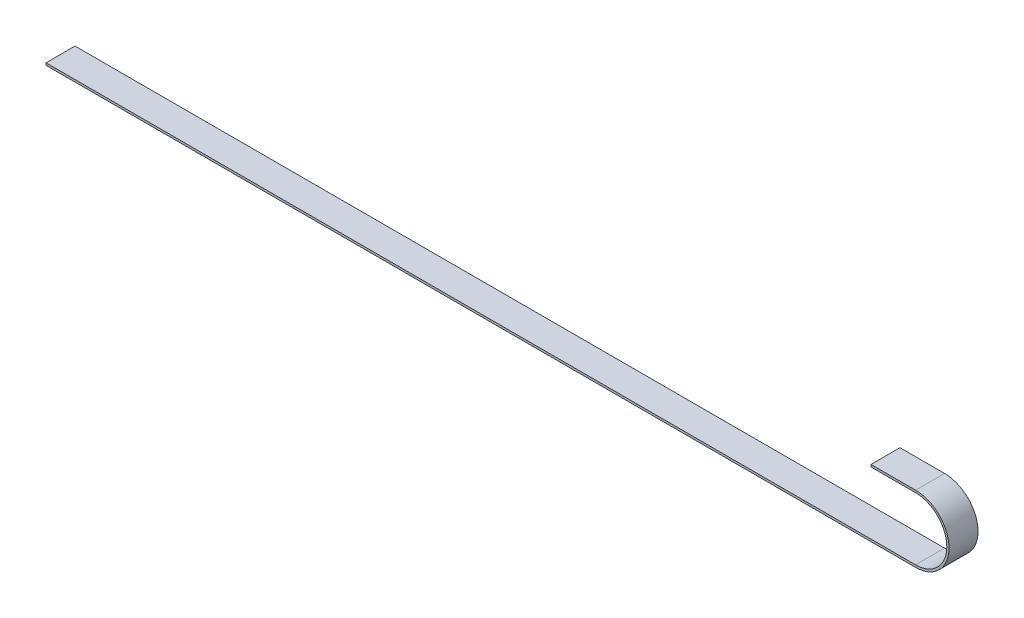
from build123d import *

# Parameters (mm, degrees)
EXTRUDE_THIN1_DEPTH = 6.5


with BuildPart() as part:
    # Sketch1 → Extrude-Thin1 (new, symmetric)
    with BuildSketch(Plane.XY):
        with BuildLine():
            Line((0, 0), (390, 0))
            ThreePointArc((390, 0), (405, 15), (390, 30))
            Line((390, 30), (370, 30))
            Line((370, 30), (370, 29))
            Line((370, 29), (390, 29))
            ThreePointArc((390, 29), (404, 15), (390, 1))
            Line((390, 1), (0, 1))
            Line((0, 1), (0, 0))
        make_face()
    extrude(amount=EXTRUDE_THIN1_DEPTH, both=True)


solid = part.part
